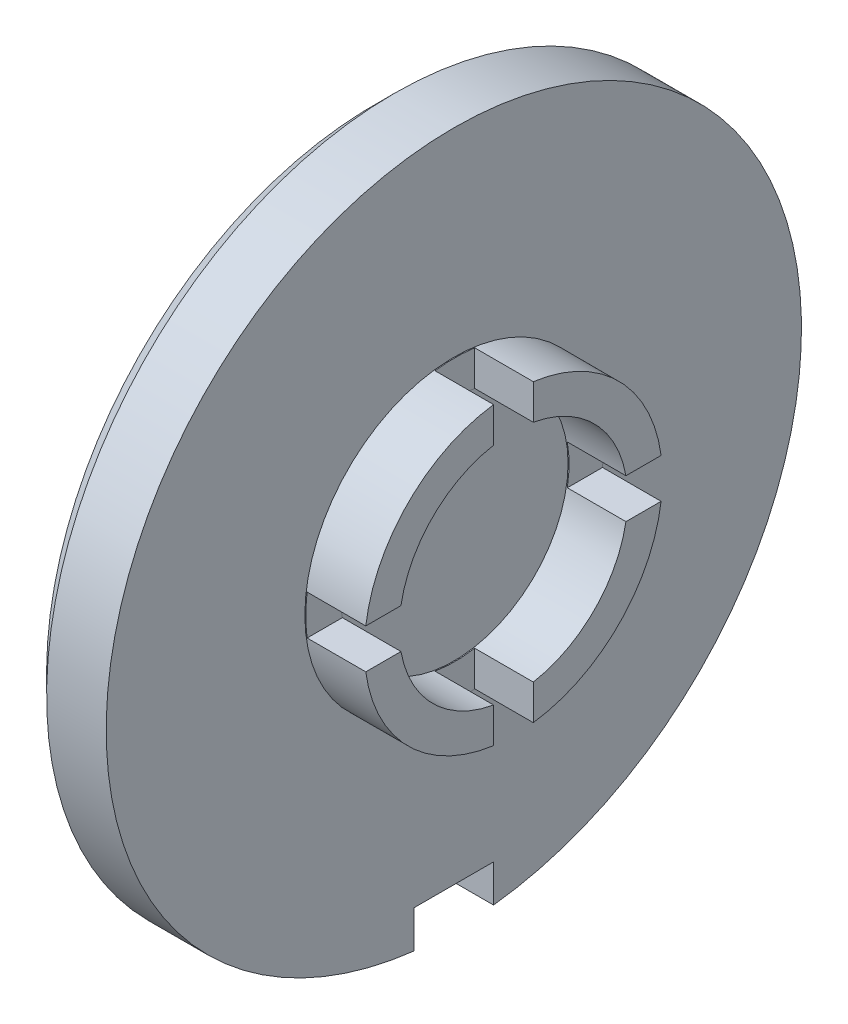
from build123d import *

# Parameters (mm, degrees)
BOSS_EXTRUDE1_START = 62.8
SKETCH2_W           = 1.28
SKETCH2_H           = 0.8
BOSS_EXTRUDE1_DEPTH = 6.4
BOSS_EXTRUDE2_START = 65.6
SKETCH3_W           = 1.28
SKETCH3_H           = 6.4
BOSS_EXTRUDE2_DEPTH = 0.8
BOSS_EXTRUDE3_START = 65.2
SKETCH4_W           = 1.8
SKETCH4_H           = 0.9
BOSS_EXTRUDE3_DEPTH = 1.6


with BuildPart() as part:
    # Sketch1 → Revolve1 (revolve)
    with BuildSketch(Plane.XY.offset(66)):
        Polygon((-82.8, -62.7), (-84, -62.7), (-84, -65), (-85.6, -65), (-85.6, -58.4), (-85.2, -58), (-84, -58), (-84, -62), (-82.8, -62), align=None)
    revolve(axis=Axis((-90.6, -65, 66), (1, 0, 0)))


with BuildPart() as body_2:
    # Sketch2 → Boss-Extrude1 (new body)
    with BuildSketch(Plane.XY.offset(BOSS_EXTRUDE1_START)):
        with Locations((-83.34, -65)):
            Rectangle(SKETCH2_W, SKETCH2_H)
    extrude(amount=BOSS_EXTRUDE1_DEPTH)


with BuildPart() as part_1:
    add(part.part)

    # Combine1: cut body 2
    add(body_2.part, mode=Mode.SUBTRACT)


with BuildPart() as body_2_2:
    # Sketch3 → Boss-Extrude2 (new body)
    with BuildSketch(Plane.XY.offset(BOSS_EXTRUDE2_START)):
        with Locations((-83.34, -65)):
            Rectangle(SKETCH3_W, SKETCH3_H)
    extrude(amount=BOSS_EXTRUDE2_DEPTH)


with BuildPart() as part_2:
    add(part_1.part)

    # Combine2: cut body 2 2
    add(body_2_2.part, mode=Mode.SUBTRACT)


with BuildPart() as body_2_3:
    # Sketch4 → Boss-Extrude3 (new body)
    with BuildSketch(Plane.XY.offset(BOSS_EXTRUDE3_START)):
        with Locations((-84.8, -71.65)):
            Rectangle(SKETCH4_W, SKETCH4_H)
    extrude(amount=BOSS_EXTRUDE3_DEPTH)


with BuildPart() as part_3:
    add(part_2.part)

    # Combine3: cut body 2 3
    add(body_2_3.part, mode=Mode.SUBTRACT)


solid = part_3.part
